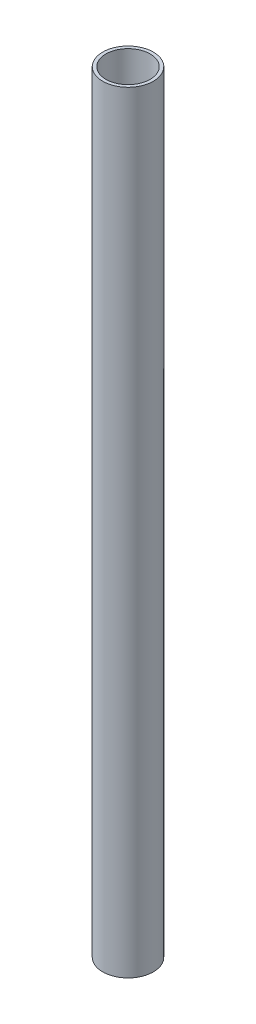
from build123d import *

# Parameters (mm, degrees)
SKETCH1_R           = 20.0025
SKETCH1_R_2         = 17.4625
BOSS_EXTRUDE1_DEPTH = 609.6


with BuildPart() as part:
    # Sketch1 → Boss-Extrude1 (new body)
    with BuildSketch(Plane(origin=(195.43209844, -85.711350663, -1333.238415073), x_dir=(0.6560430593860989, 0, 0.7547234620914655), z_dir=(0, 1, 0))):
        with Locations(Location((102.408934419, 86.291983134, 0), (0, 0, 139.001212364))):
            Circle(SKETCH1_R)
        with Locations(Location((102.408934419, 86.291983134, 0), (0, 0, 139.001212364))):
            Circle(SKETCH1_R_2, mode=Mode.SUBTRACT)
    extrude(amount=BOSS_EXTRUDE1_DEPTH)


solid = part.part
